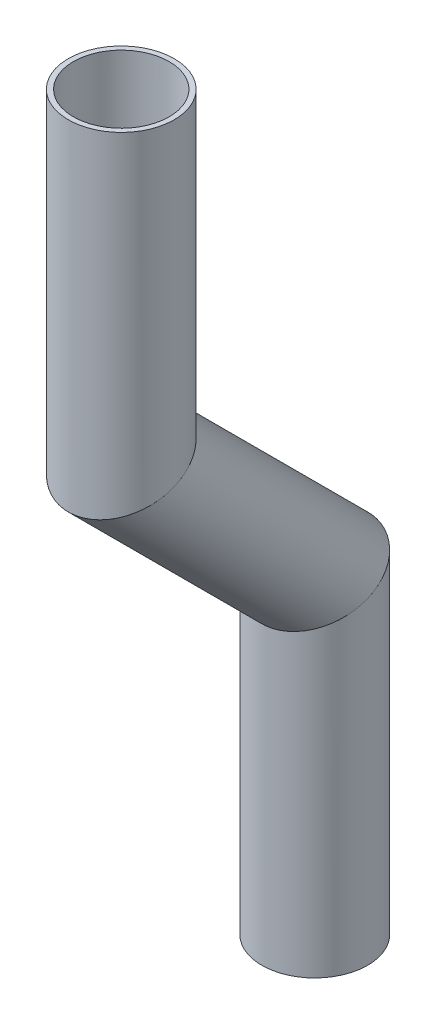
from build123d import *

# Parameters (mm, degrees)
SKETCH11_R                = 6.35
SKETCH11_R_2              = 5.7404
PIPE_0_5_SCH_40_1_DEPTH   = 42.819743879
SKETCH11_ON_SEGMENT_2_R   = 6.35
SKETCH11_ON_SEGMENT_2_R_2 = 5.7404
PIPE_0_5_SCH_40_1_2_DEPTH = 42.248994938
SKETCH11_ON_SEGMENT_3_R   = 6.35
SKETCH11_ON_SEGMENT_3_R_2 = 5.7404
PIPE_0_5_SCH_40_1_3_DEPTH = 42.819743879


with BuildPart() as part:
    # Sketch11 → Pipe 0.5 SCH 40(1) (new body)
    with BuildSketch(Plane(origin=(0, -54.917413554, 302.572169571), x_dir=(0, 0, -1), z_dir=(0, -1, 0))):
        Circle(SKETCH11_R)
        Circle(SKETCH11_R_2, mode=Mode.SUBTRACT)
    extrude(amount=PIPE_0_5_SCH_40_1_DEPTH)

    # Pipe 0.5 SCH 40(1) mitre 1
    split(bisect_by=Plane(origin=(0, -93.017413554, 302.572169571), x_dir=(-1, 0, 0), z_dir=(0, 0.923879533, 0.382683432)), keep=Keep.TOP)


with BuildPart() as body_2:
    # Sketch11 on segment 2 (carried to segment 2) → Pipe 0.5 SCH 40_1 2 (new body)
    with BuildSketch(Plane(origin=(0, -89.680050651, 305.909532473), x_dir=(0, 0.707106781, -0.707106781), z_dir=(0, -0.707106781, -0.707106781))):
        Circle(SKETCH11_ON_SEGMENT_2_R)
        Circle(SKETCH11_ON_SEGMENT_2_R_2, mode=Mode.SUBTRACT)
    extrude(amount=PIPE_0_5_SCH_40_1_2_DEPTH)

    # Pipe 0.5 SCH 40_1 2 mitre 1
    split(bisect_by=Plane(origin=(0, -93.017413554, 302.572169571), x_dir=(1, 0, 0), z_dir=(0, -0.923879533, -0.382683432)), keep=Keep.TOP)

    # Pipe 0.5 SCH 40_1 2 mitre 2
    split(bisect_by=Plane(origin=(0, -116.217238568, 279.372344556), x_dir=(-1, 0, 0), z_dir=(0, 0.923879533, 0.382683432)), keep=Keep.TOP)


with BuildPart() as body_3:
    # Sketch11 on segment 3 (carried to segment 3) → Pipe 0.5 SCH 40_1 3 (new body)
    with BuildSketch(Plane(origin=(0, -111.497494689, 279.372344556), x_dir=(0, 0, -1), z_dir=(0, -1, 0))):
        Circle(SKETCH11_ON_SEGMENT_3_R)
        Circle(SKETCH11_ON_SEGMENT_3_R_2, mode=Mode.SUBTRACT)
    extrude(amount=PIPE_0_5_SCH_40_1_3_DEPTH)

    # Pipe 0.5 SCH 40_1 3 mitre 1
    split(bisect_by=Plane(origin=(0, -116.217238568, 279.372344556), x_dir=(1, 0, 0), z_dir=(0, -0.923879533, -0.382683432)), keep=Keep.TOP)


solid = Compound([part.part, body_2.part, body_3.part])
